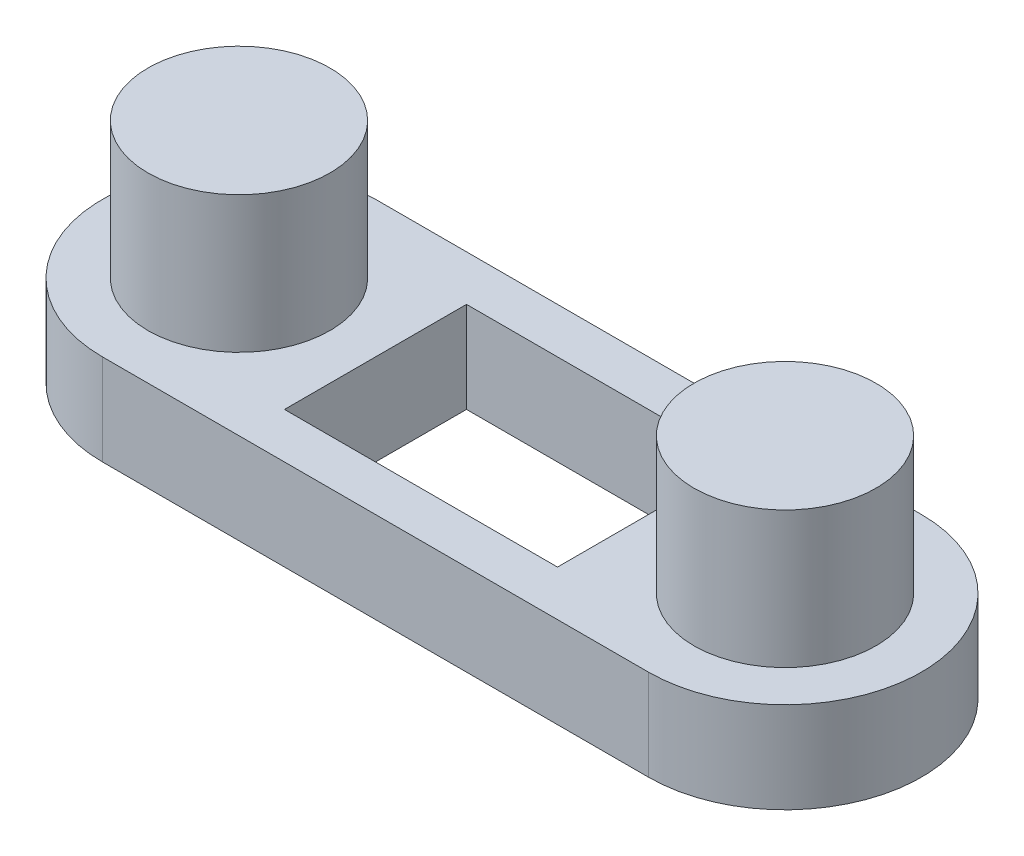
from build123d import *

# Parameters (mm, degrees)
BOSS_EXTRUDE1_DEPTH = 10
SKETCH2_W           = 30
SKETCH2_H           = 20
CUT_EXTRUDE1_DEPTH  = 10
SKETCH3_R           = 10
BOSS_EXTRUDE2_DEPTH = 15


with BuildPart() as part:
    # Sketch1 → Boss-Extrude1 (new body)
    with BuildSketch(Plane(origin=(0, 0, 0), x_dir=(1, 0, 0), z_dir=(0, 1, 0))):
        with BuildLine():
            Line((30, -15), (-30, -15))
            ThreePointArc((-30, -15), (-45, 0), (-30, 15))
            Line((-30, 15), (30, 15))
            ThreePointArc((30, 15), (45, 0), (30, -15))
        make_face()
    extrude(amount=BOSS_EXTRUDE1_DEPTH)

    # Sketch2 → Cut-Extrude1 (cut)
    with BuildSketch(Plane(origin=(0, 10, 0), x_dir=(1, 0, 0), z_dir=(0, 1, 0))):
        Rectangle(SKETCH2_W, SKETCH2_H)
    extrude(amount=-CUT_EXTRUDE1_DEPTH, mode=Mode.SUBTRACT)

    # Sketch3 → Boss-Extrude2 (add)
    with BuildSketch(Plane(origin=(0, 10, 0), x_dir=(1, 0, 0), z_dir=(0, 1, 0))):
        with Locations(Location((-30, 0, 0), (0, 0, 270))):
            Circle(SKETCH3_R)
        with Locations(Location((30, 0, 0), (0, 0, 270))):
            Circle(SKETCH3_R)
    extrude(amount=BOSS_EXTRUDE2_DEPTH)


solid = part.part
